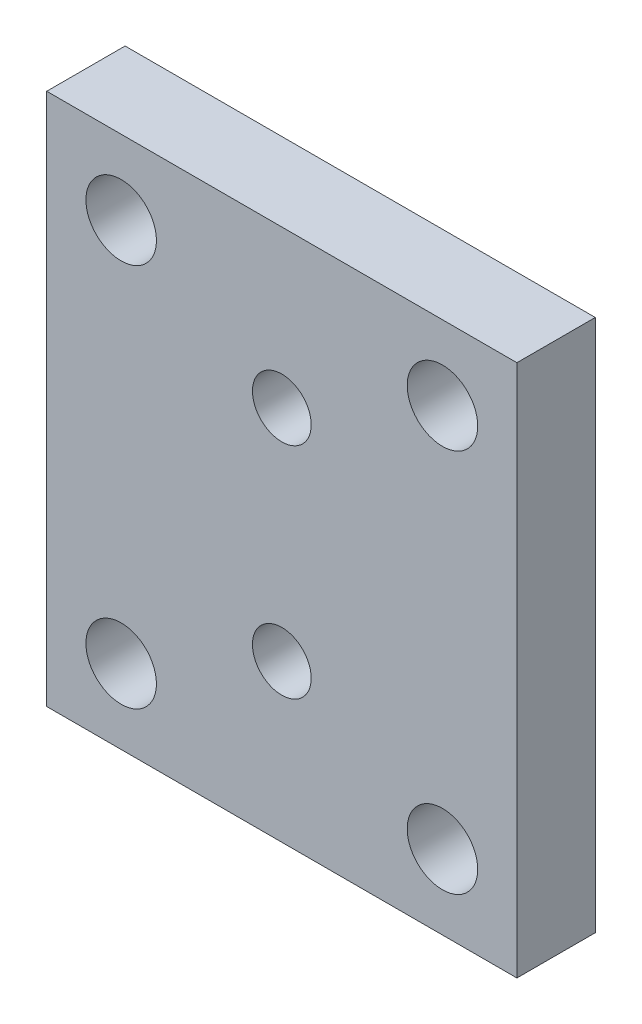
from build123d import *

# Parameters (mm, degrees)
SKETCH1_W           = 30
SKETCH1_H           = 34
SKETCH1_R           = 2.25
SKETCH1_R_2         = 1.875
BOSS_EXTRUDE1_DEPTH = 5


with BuildPart() as part:
    # Sketch1 → Boss-Extrude1 (new body)
    with BuildSketch(Plane.XY):
        with Locations((15, 17)):
            Rectangle(SKETCH1_W, SKETCH1_H)
        with Locations((4.75, 29.25)):
            Circle(SKETCH1_R, mode=Mode.SUBTRACT)
        with Locations((25.25, 29.25)):
            Circle(SKETCH1_R, mode=Mode.SUBTRACT)
        with Locations((25.25, 4.75)):
            Circle(SKETCH1_R, mode=Mode.SUBTRACT)
        with Locations((4.75, 4.75)):
            Circle(SKETCH1_R, mode=Mode.SUBTRACT)
        with Locations((15, 24)):
            Circle(SKETCH1_R_2, mode=Mode.SUBTRACT)
        with Locations((15, 10)):
            Circle(SKETCH1_R_2, mode=Mode.SUBTRACT)
    extrude(amount=BOSS_EXTRUDE1_DEPTH)


solid = part.part
